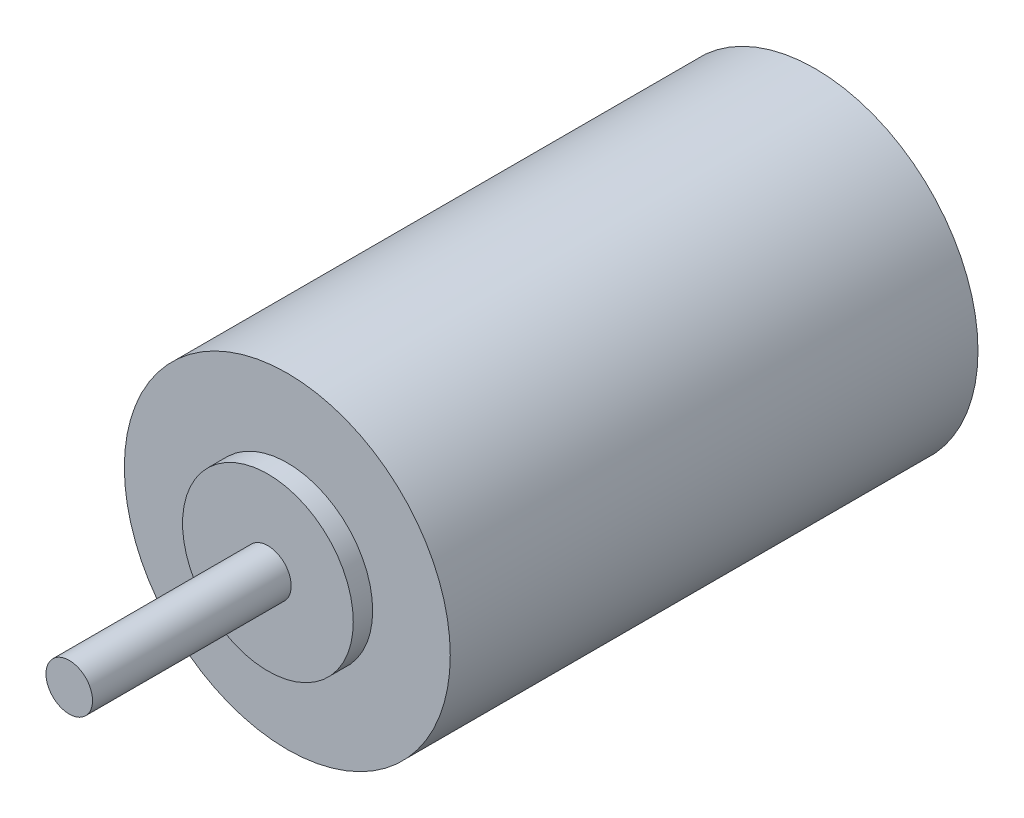
from build123d import *

# Parameters (mm, degrees)
CROQUIS1_R              = 21
SALIENTE_EXTRUIR1_DEPTH = 68
CROQUIS2_R              = 11
SALIENTE_EXTRUIR2_DEPTH = 2.5
CROQUIS3_R              = 3
SALIENTE_EXTRUIR3_DEPTH = 25.6


with BuildPart() as part:
    # Croquis1 → Saliente-Extruir1 (new body)
    with BuildSketch(Plane.XY):
        Circle(CROQUIS1_R)
    extrude(amount=SALIENTE_EXTRUIR1_DEPTH)

    # Croquis2 → Saliente-Extruir2 (add)
    with BuildSketch(Plane.XY.offset(68)):
        Circle(CROQUIS2_R)
    extrude(amount=SALIENTE_EXTRUIR2_DEPTH)

    # Croquis3 → Saliente-Extruir3 (add)
    with BuildSketch(Plane.XY.offset(70.5)):
        Circle(CROQUIS3_R)
    extrude(amount=SALIENTE_EXTRUIR3_DEPTH)


solid = part.part
